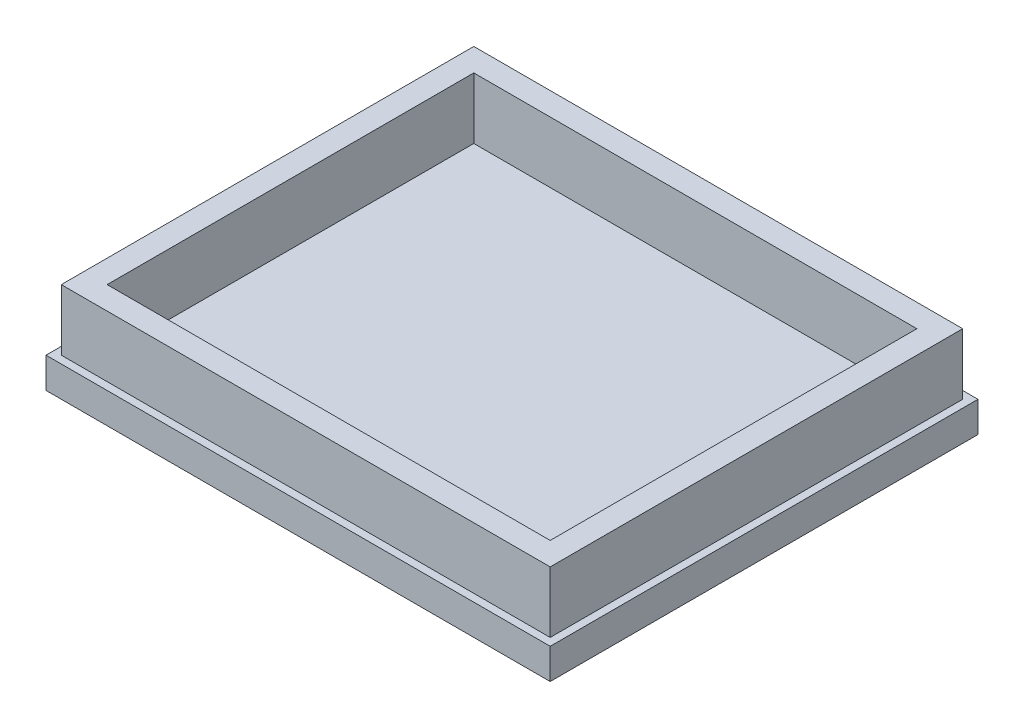
from build123d import *

# Parameters (mm, degrees)
SKETCH_1_W      = 33
SKETCH_1_H      = 28
EXTRUDE_1_DEPTH = 2
SKETCH_2_W      = 32
SKETCH_2_H      = 27
SKETCH_2_W_2    = 29
SKETCH_2_H_2    = 24
EXTRUDE_2_DEPTH = 4


with BuildPart() as part:
    # 草图1 → 凸台-拉伸1 (new body)
    with BuildSketch(Plane(origin=(0, 0, 0), x_dir=(1, 0, 0), z_dir=(0, 1, 0))):
        with Locations((16.5, -14)):
            Rectangle(SKETCH_1_W, SKETCH_1_H)
    extrude(amount=EXTRUDE_1_DEPTH)

    # 草图2 → 凸台-拉伸2 (add)
    with BuildSketch(Plane(origin=(0, 2, 0), x_dir=(1, 0, 0), z_dir=(0, 1, 0))):
        with Locations((16.5, -14)):
            Rectangle(SKETCH_2_W, SKETCH_2_H)
        with Locations((16.5, -14)):
            Rectangle(SKETCH_2_W_2, SKETCH_2_H_2, mode=Mode.SUBTRACT)
    extrude(amount=EXTRUDE_2_DEPTH)


solid = part.part
